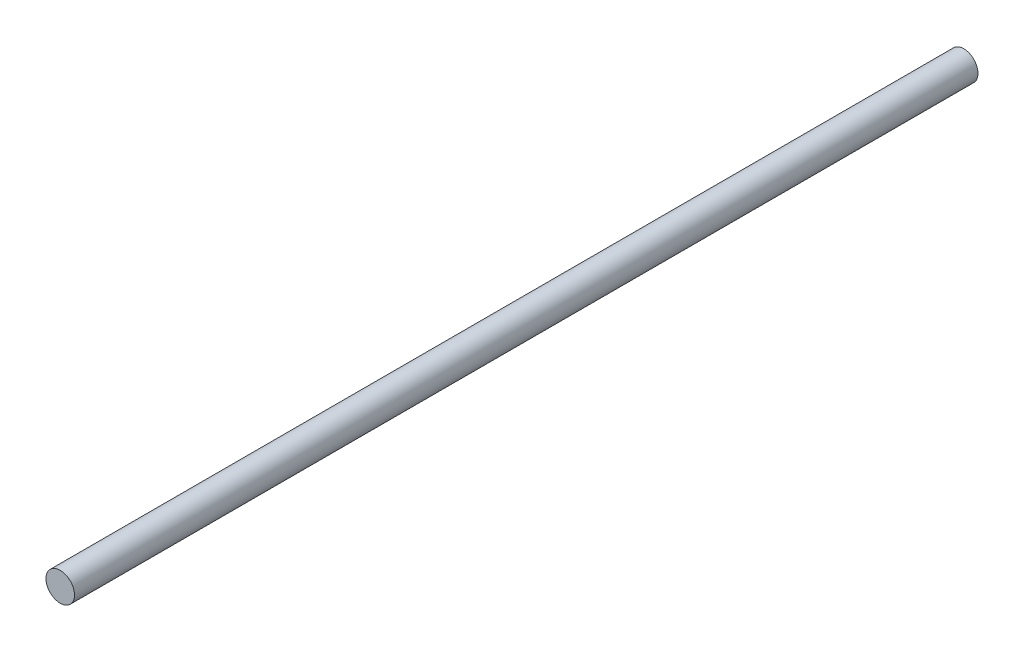
from build123d import *

# Parameters (mm, degrees)
ESQUISSE1_R        = 1.5
BOSS_EXTRU_1_DEPTH = 95


with BuildPart() as part:
    # Esquisse1 → Boss.-Extru.1 (new body)
    with BuildSketch(Plane.XY):
        Circle(ESQUISSE1_R)
    extrude(amount=BOSS_EXTRU_1_DEPTH)


solid = part.part
